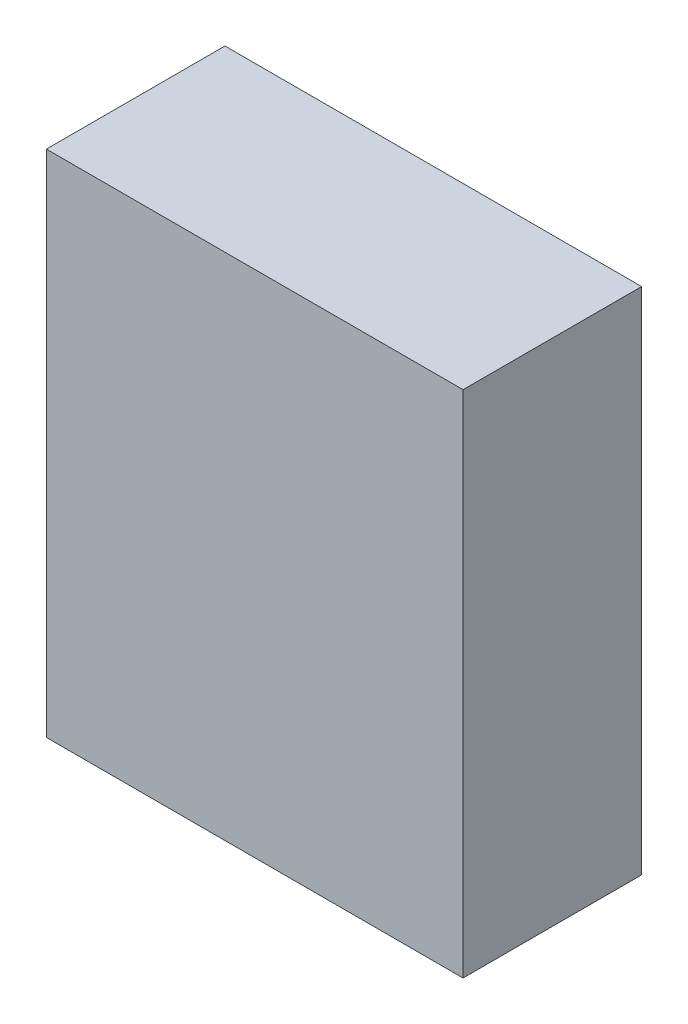
from build123d import *

# Parameters (mm, degrees)
SKETCH1_W           = 88.9
SKETCH1_H           = 38.1
BOSS_EXTRUDE1_DEPTH = 108.712


with BuildPart() as part:
    # Sketch1 → Boss-Extrude1 (new body)
    with BuildSketch(Plane(origin=(0, 0, 0), x_dir=(1, 0, 0), z_dir=(0, 1, 0))):
        with Locations((44.45, 19.05)):
            Rectangle(SKETCH1_W, SKETCH1_H)
    extrude(amount=BOSS_EXTRUDE1_DEPTH)


solid = part.part
